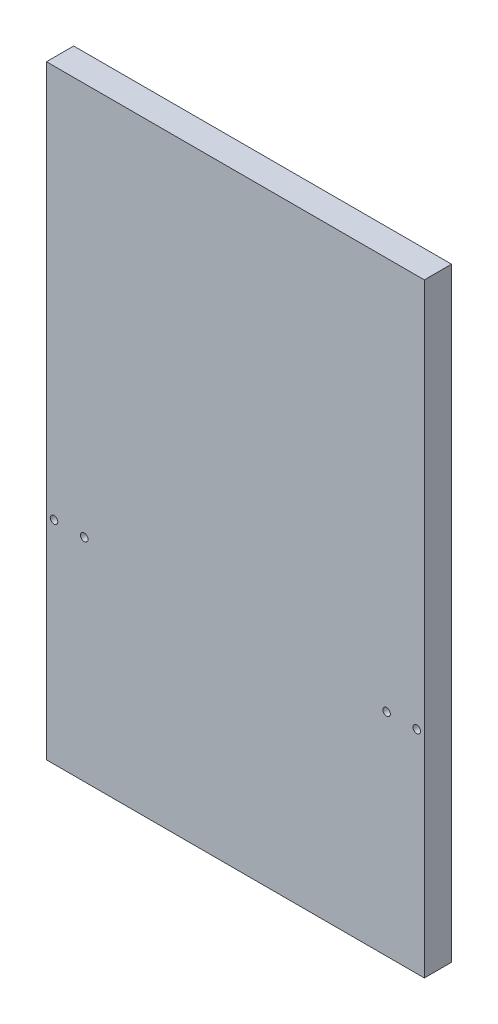
from build123d import *

# Parameters (mm, degrees)
ESQUISSE1_W        = 250
ESQUISSE1_H        = 400
ESQUISSE1_R        = 2.5
BOSS_EXTRU_1_DEPTH = 18


with BuildPart() as part:
    # Esquisse1 → Boss.-Extru.1 (new body)
    with BuildSketch(Plane.XY):
        with Locations((125, 200)):
            Rectangle(ESQUISSE1_W, ESQUISSE1_H)
        with Locations((245, 140)):
            Circle(ESQUISSE1_R, mode=Mode.SUBTRACT)
        with Locations((225, 140)):
            Circle(ESQUISSE1_R, mode=Mode.SUBTRACT)
        with Locations((5, 140)):
            Circle(ESQUISSE1_R, mode=Mode.SUBTRACT)
        with Locations((25, 140)):
            Circle(ESQUISSE1_R, mode=Mode.SUBTRACT)
    extrude(amount=BOSS_EXTRU_1_DEPTH)


solid = part.part
